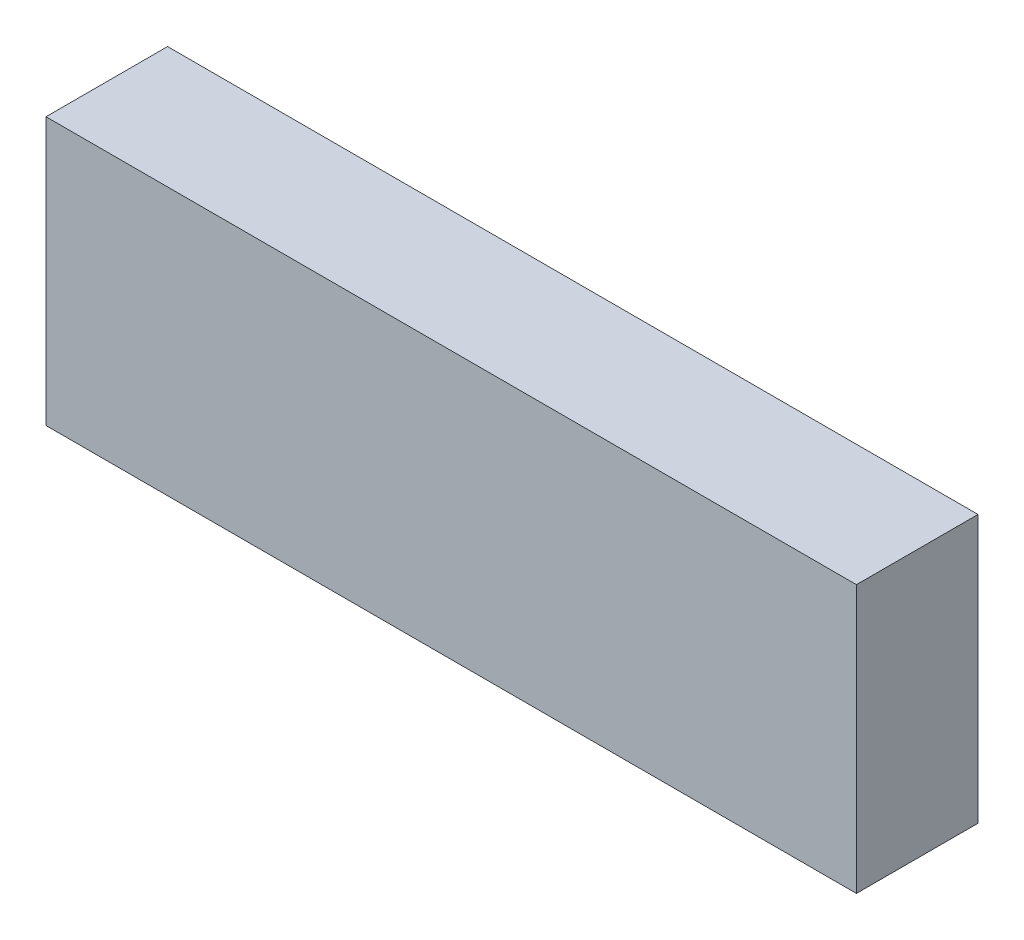
from build123d import *

# Parameters (mm, degrees)
ESBO_O1_W                = 100
ESBO_O1_H                = 33
RESSALTO_EXTRUS_O1_DEPTH = 15


with BuildPart() as part:
    # Esboço1 → Ressalto-extrusão1 (new body)
    with BuildSketch(Plane.XY):
        Rectangle(ESBO_O1_W, ESBO_O1_H)
    extrude(amount=RESSALTO_EXTRUS_O1_DEPTH)


solid = part.part
